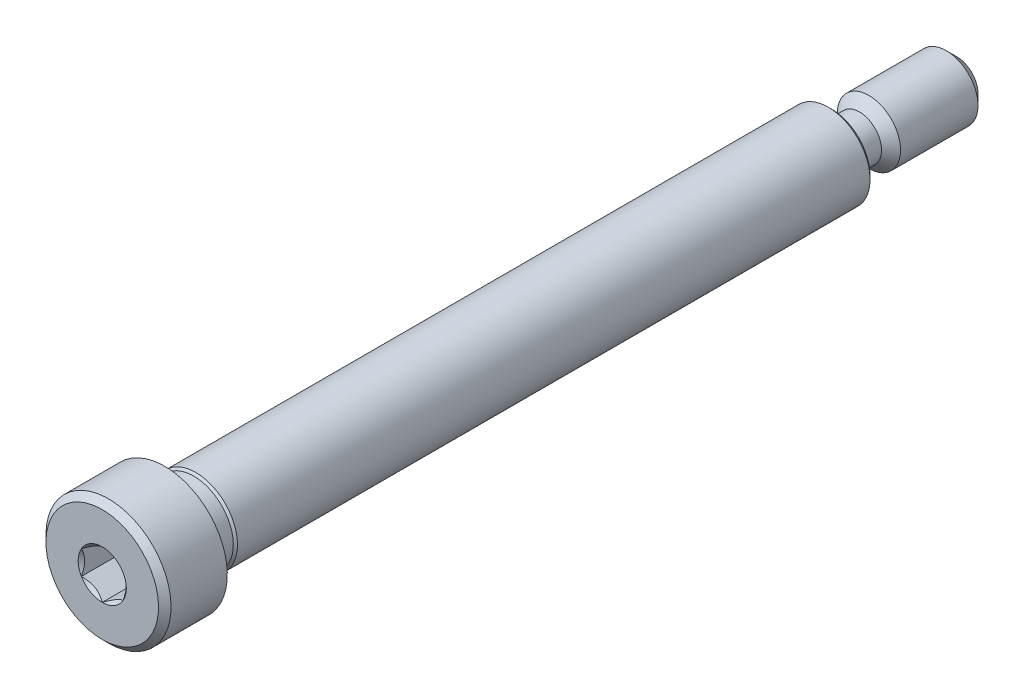
from build123d import *

# Parameters (mm, degrees)
CUT_EXTRUDE1_DEPTH = 3.571875


with BuildPart() as part:
    # Sketch4 → Revolve1 (revolve)
    with BuildSketch(Plane(origin=(0, 0, 0), x_dir=(0, 0, -1), z_dir=(1, 0, 0))):
        Polygon((-27.78125, 4.7625), (-32.0675, 4.7625), (-32.54375, 4.28625), (-32.54375, 0), (23.01875, 0), (23.01875, 2.921), (22.76475, 3.175), (-25.41905, 3.175), (-25.5778, 3.01625), (-27.6225, 3.01625), (-27.78125, 3.175), align=None)
    revolve(axis=Axis((0, 0, 32.54375), (0, 0, -1)))

    # Sketch5 → Cut-Extrude1 (cut)
    with BuildSketch(Plane.XY.offset(32.54375)):
        Polygon((1.5875, 0.916543552), (0, 1.833087105), (-1.5875, 0.916543552), (-1.5875, -0.916543552), (0, -1.833087105), (1.5875, -0.916543552), align=None)
    extrude(amount=-CUT_EXTRUDE1_DEPTH, mode=Mode.SUBTRACT)

    # Cut-Extrude4 cone 1 section (through the dimple's axis) → Cut-Extrude4 (revolve, cut)
    with BuildSketch(Plane(origin=(0, 0, 32.54375), x_dir=(0, -1, 0), z_dir=(1, 0, 0))):
        Polygon((0, 0), (1.833087105, 0), (0, 1.833087105), align=None)
    revolve(axis=Axis((0, 0, 32.54375), (0, 0, -1)), mode=Mode.SUBTRACT)

    # Sketch7 → Revolve2 (revolve)
    with BuildSketch(Plane(origin=(0, 0, 0), x_dir=(0, 0, -1), z_dir=(1, 0, 0))):
        Polygon((23.01875, 2.413), (31.75, 2.413), (32.54375, 1.61925), (32.54375, 0), (23.01875, 0), align=None)
    revolve(axis=Axis((0, 0, -32.54375), (0, 0, 1)))

    # Sketch10 → Cut-Revolve1 (revolve, cut)
    with BuildSketch(Plane(origin=(0, 0, 0), x_dir=(0, 0, -1), z_dir=(1, 0, 0))):
        with BuildLine():
            Line((23.74265, 1.6891), (25.12695, 1.6891))
            Line((25.12695, 1.6891), (26.61285, 3.175))
            Line((26.61285, 3.175), (23.01875, 3.175))
            Line((23.01875, 3.175), (23.01875, 2.413))
            ThreePointArc((23.01875, 2.413), (23.230775401, 1.901125401), (23.74265, 1.6891))
        make_face()
    revolve(axis=Axis((0, 0, -32.54375), (0, 0, 1)), mode=Mode.SUBTRACT)


solid = part.part
